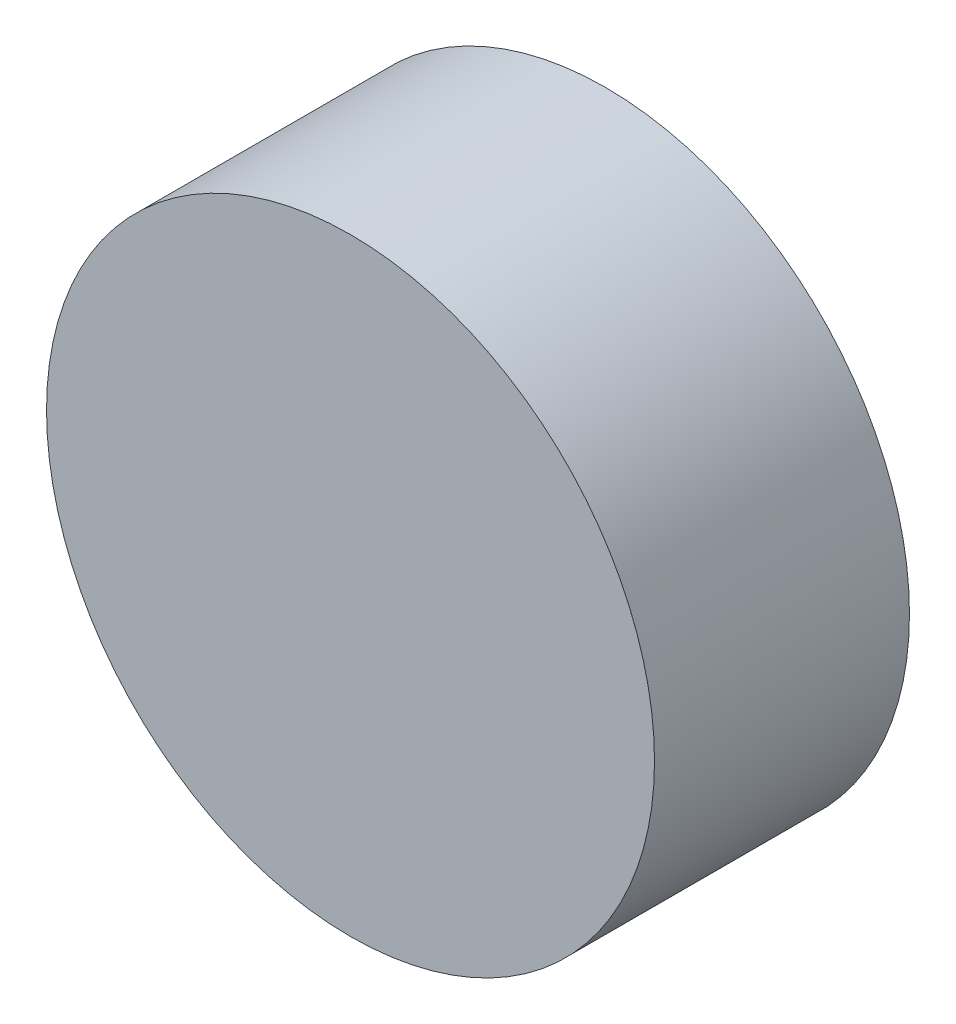
from build123d import *

# Parameters (mm, degrees)
CROQUIS1_R              = 31
SALIENTE_EXTRUIR1_DEPTH = 26


with BuildPart() as part:
    # Croquis1 → Saliente-Extruir1 (new body)
    with BuildSketch(Plane.XY):
        with Locations(Location((0, 0, 0), (0, 0, 180))):
            Circle(CROQUIS1_R)
    extrude(amount=SALIENTE_EXTRUIR1_DEPTH)


solid = part.part
